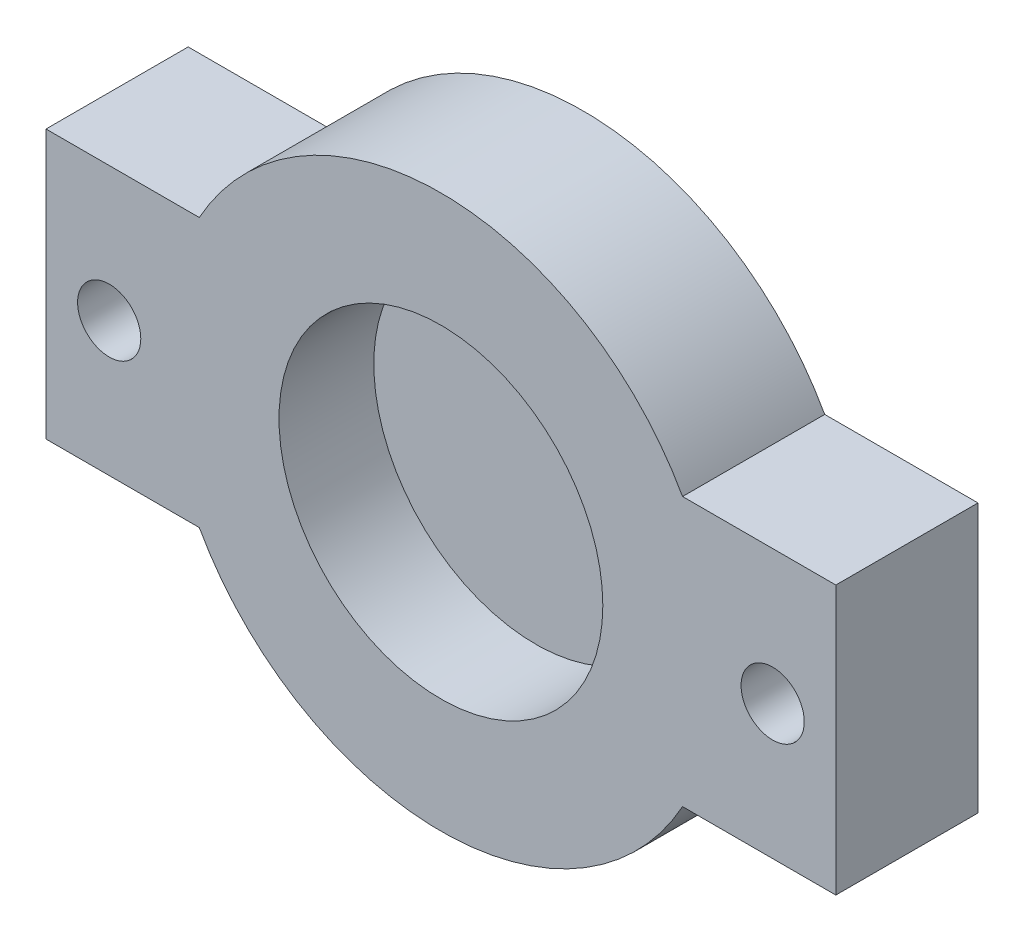
from build123d import *

# Parameters (mm, degrees)
SKETCH1_R           = 2
BOSS_EXTRUDE3_DEPTH = 9
SKETCH2_R           = 10.25
CUT_EXTRUDE1_DEPTH  = 6


with BuildPart() as part:
    # Sketch1 → Boss-Extrude3 (new body)
    # profile 1 of 5: a face of its own
    with BuildSketch(Plane.XY):
        with BuildLine():
            Line((-25, 8.5), (-25, -8.5))
            Line((-25, -8.5), (-15.297058541, -8.5))
            ThreePointArc((-15.297058541, -8.5), (-17.5, 0), (-15.297058541, 8.5))
            Line((-15.297058541, 8.5), (-25, 8.5))
        make_face()
        with Locations((-21, 0)):
            Circle(SKETCH1_R, mode=Mode.SUBTRACT)
    # profile 2 of 5: a face of its own
    with BuildSketch(Plane.XY):
        with BuildLine():
            ThreePointArc((15.297058541, 8.5), (0, 17.5), (-15.297058541, 8.5))
            Line((-15.297058541, 8.5), (15.297058541, 8.5))
        make_face()
    # profile 3 of 5: a face of its own
    with BuildSketch(Plane.XY):
        with BuildLine():
            ThreePointArc((-15.297058541, 8.5), (-17.5, 0), (-15.297058541, -8.5))
            Line((-15.297058541, -8.5), (15.297058541, -8.5))
            ThreePointArc((15.297058541, -8.5), (16.940314703, -4.390414305), (17.5, 0))
            ThreePointArc((17.5, 0), (16.940314703, 4.390414305), (15.297058541, 8.5))
            Line((15.297058541, 8.5), (-15.297058541, 8.5))
        make_face()
    # profile 4 of 5: a face of its own
    with BuildSketch(Plane.XY):
        with BuildLine():
            Line((15.297058541, -8.5), (-15.297058541, -8.5))
            ThreePointArc((-15.297058541, -8.5), (0, -17.5), (15.297058541, -8.5))
        make_face()
    # profile 5 of 5: a face of its own
    with BuildSketch(Plane.XY):
        with BuildLine():
            ThreePointArc((17.5, 0), (16.940314703, -4.390414305), (15.297058541, -8.5))
            Line((15.297058541, -8.5), (25, -8.5))
            Line((25, -8.5), (25, 8.5))
            Line((25, 8.5), (15.297058541, 8.5))
            ThreePointArc((15.297058541, 8.5), (16.940314703, 4.390414305), (17.5, 0))
        make_face()
        with Locations((21, 0)):
            Circle(SKETCH1_R, mode=Mode.SUBTRACT)
    extrude(amount=BOSS_EXTRUDE3_DEPTH)

    # Sketch2 → Cut-Extrude1 (cut)
    with BuildSketch(Plane.XY.offset(9)):
        Circle(SKETCH2_R)
    extrude(amount=-CUT_EXTRUDE1_DEPTH, mode=Mode.SUBTRACT)


solid = part.part
